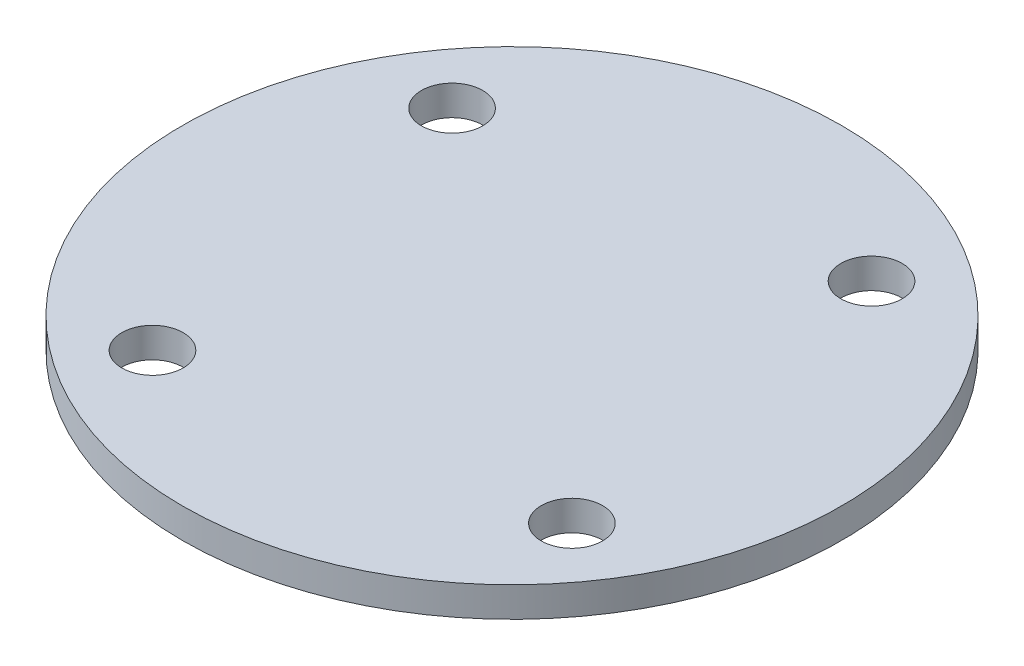
from build123d import *

# Parameters (mm, degrees)
SKETCH1_R           = 27.94
BOSS_EXTRUDE1_DEPTH = 2.54
SKETCH2_R           = 2.6
CUT_EXTRUDE1_DEPTH  = 40.594681461
CIRPATTERN1_COUNT   = 4


with BuildPart() as part:
    # Sketch1 → Boss-Extrude1 (new body)
    with BuildSketch(Plane(origin=(0, 0, 0), x_dir=(1, 0, 0), z_dir=(0, 1, 0))):
        with Locations(Location((0, 0, 0), (0, 0, 270))):
            Circle(SKETCH1_R)
    extrude(amount=BOSS_EXTRUDE1_DEPTH)

    # Sketch2 → Cut-Extrude1 (cut, through all)
    with BuildSketch(Plane(origin=(0, 2.54, 0), x_dir=(1, 0, 0), z_dir=(0, 1, 0))):
        with Locations(Location((-12.7, -17.78, 0), (0, 0, 270))):
            Circle(SKETCH2_R)
    cut_extrude1 = extrude(amount=-CUT_EXTRUDE1_DEPTH, mode=Mode.SUBTRACT)

    # CirPattern1: Cut-Extrude1 ×4 about axis
    cirpattern1_axis = Axis((0, 0, 0), (0, 1, 0))
    for i in range(1, CIRPATTERN1_COUNT):
        add(cut_extrude1.rotate(cirpattern1_axis, i * 360 / CIRPATTERN1_COUNT), mode=Mode.SUBTRACT)


solid = part.part
